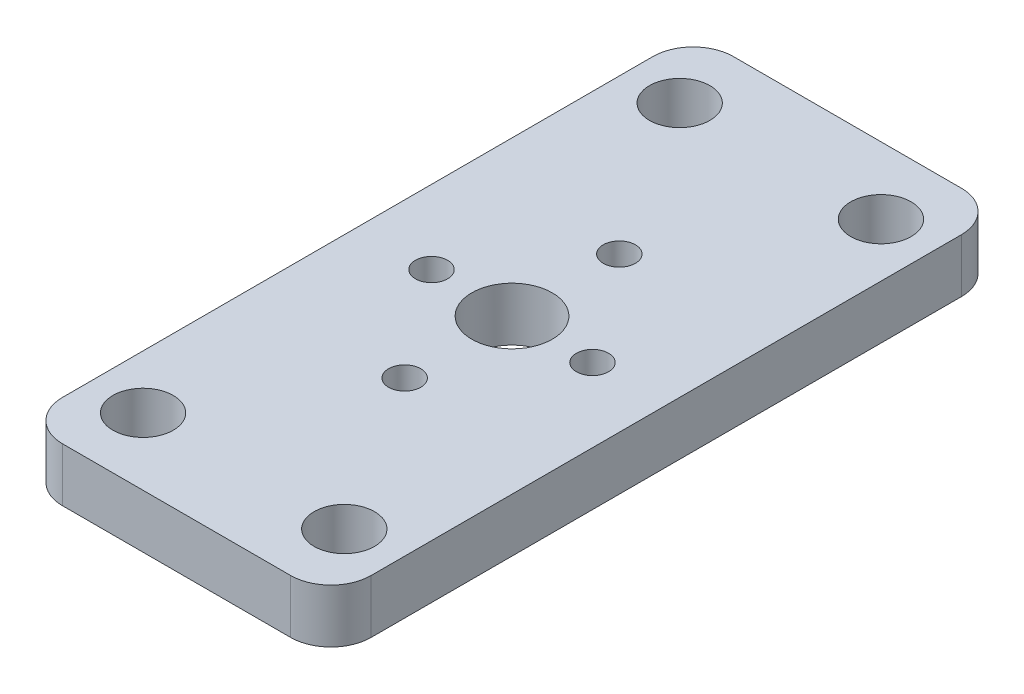
from build123d import *

# Parameters (mm, degrees)
SKETCH1_W                                        = 23
SKETCH1_H                                        = 50
BOSS_EXTRUDE1_DEPTH                              = 4
M4_CLEARANCE_HOLE1_D                             = 4.5
FILLET1_R                                        = 3
SKETCH4_R                                        = 3
CUT_EXTRUDE1_DEPTH                               = 10
CBORE_FOR_M2_PAN_HEAD_MACHINE_SCREW1_D           = 2.4
CBORE_FOR_M2_PAN_HEAD_MACHINE_SCREW1_CBORE_D     = 5
CBORE_FOR_M2_PAN_HEAD_MACHINE_SCREW1_CBORE_DEPTH = 1.6


with BuildPart() as part:
    # Sketch1 → Boss-Extrude1 (new body)
    with BuildSketch(Plane(origin=(0, 0, 0), x_dir=(1, 0, 0), z_dir=(0, 1, 0))):
        Rectangle(SKETCH1_W, SKETCH1_H)
    extrude(amount=BOSS_EXTRUDE1_DEPTH)

    # M4 Clearance Hole1 (through all)
    with Locations(Plane(origin=(0, 4, 0), x_dir=(1, 0, 0), z_dir=(0, 1, 0))):
        with Locations((-7.5, 20), (7.5, 20), (-7.5, -20), (7.5, -20)):
            Hole(M4_CLEARANCE_HOLE1_D / 2)

    # Fillet1
    fillet1_edges = [part.edges().sort_by_distance(p)[0] for p in [
        (11.5, 2, 25),
        (-11.5, 2, 25),
        (-11.5, 2, -25),
        (11.5, 2, -25),
    ]]
    fillet(fillet1_edges, radius=FILLET1_R)

    # Sketch4 → Cut-Extrude1 (cut)
    with BuildSketch(Plane(origin=(0, 0, 0), x_dir=(1, 0, 0), z_dir=(0, 1, 0))):
        with Locations(Location((0, 0, 0), (0, 0, 90))):
            Circle(SKETCH4_R)
    extrude(amount=CUT_EXTRUDE1_DEPTH, mode=Mode.SUBTRACT)

    # CBORE for M2 Pan Head Machine Screw1 (through all)
    with Locations(Plane(origin=(0, 0, 0), x_dir=(-1, 0, 0), z_dir=(0, -1, 0))):
        with Locations((0, -8), (-6, 0), (0, 8), (6, 0)):
            CounterBoreHole(CBORE_FOR_M2_PAN_HEAD_MACHINE_SCREW1_D / 2, CBORE_FOR_M2_PAN_HEAD_MACHINE_SCREW1_CBORE_D / 2, CBORE_FOR_M2_PAN_HEAD_MACHINE_SCREW1_CBORE_DEPTH)


solid = part.part
